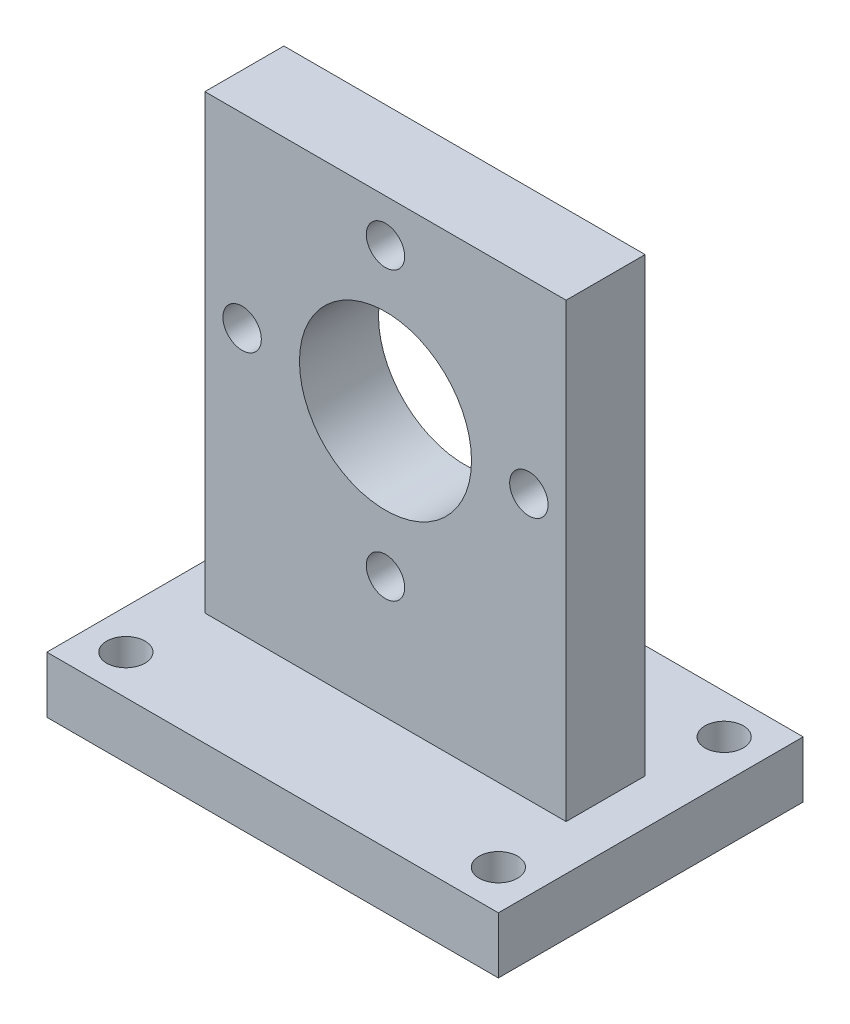
from build123d import *

# Parameters (mm, degrees)
SKETCH1_W           = 40
SKETCH1_H           = 27
SKETCH1_W_2         = 32
SKETCH1_H_2         = 7
BOSS_EXTRUDE1_DEPTH = 5
SKETCH1_3_W         = 32
SKETCH1_3_H         = 7
BOSS_EXTRUDE2_DEPTH = 45
CUT_EXTRUDE1_REACH  = 54.096
SKETCH2_R           = 7.62
CUT_EXTRUDE2_REACH  = 54.096
SKETCH4_R           = 1.7
CUT_EXTRUDE3_REACH  = 48.715
SKETCH5_R           = 1.7


with BuildPart() as part:
    # Sketch1 → Boss-Extrude1 (new body)
    with BuildSketch(Plane(origin=(0, 0, 0), x_dir=(1, 0, 0), z_dir=(0, 1, 0))):
        Rectangle(SKETCH1_W, SKETCH1_H)
        Rectangle(SKETCH1_W_2, SKETCH1_H_2, mode=Mode.SUBTRACT)
    extrude(amount=BOSS_EXTRUDE1_DEPTH)

    # Sketch1<3> → Boss-Extrude2 (add)
    with BuildSketch(Plane(origin=(0, 0, 0), x_dir=(1, 0, 0), z_dir=(0, 1, 0))):
        Rectangle(SKETCH1_3_W, SKETCH1_3_H)
    extrude(amount=BOSS_EXTRUDE2_DEPTH)

    # Sketch2 → Cut-Extrude1 (cut, up to next)
    with BuildSketch(Plane.XY.offset(3.5), mode=Mode.PRIVATE) as cut_extrude1_sk1:
        with Locations((0, 28.5)):
            Circle(SKETCH2_R)
    cut_extrude1_tool1 = extrude(cut_extrude1_sk1.sketch, amount=-CUT_EXTRUDE1_REACH, mode=Mode.PRIVATE) & part.part
    add(cut_extrude1_tool1.solids().sort_by_distance((0, 28.5, 3.5))[0], mode=Mode.SUBTRACT)

    # Sketch4 → Cut-Extrude2 (cut, up to next)
    with BuildSketch(Plane.XY.offset(3.5), mode=Mode.PRIVATE) as cut_extrude2_sk1:
        with Locations((0, 41.2)):
            Circle(SKETCH4_R)
    cut_extrude2_tool1 = extrude(cut_extrude2_sk1.sketch, amount=-CUT_EXTRUDE2_REACH, mode=Mode.PRIVATE) & part.part
    # Sketch4 → Cut-Extrude2 (cut, up to next)
    with BuildSketch(Plane.XY.offset(3.5), mode=Mode.PRIVATE) as cut_extrude2_sk2:
        with Locations((12.7, 28.5)):
            Circle(SKETCH4_R)
    cut_extrude2_tool2 = extrude(cut_extrude2_sk2.sketch, amount=-CUT_EXTRUDE2_REACH, mode=Mode.PRIVATE) & part.part
    # Sketch4 → Cut-Extrude2 (cut, up to next)
    with BuildSketch(Plane.XY.offset(3.5), mode=Mode.PRIVATE) as cut_extrude2_sk3:
        with Locations((0, 15.8)):
            Circle(SKETCH4_R)
    cut_extrude2_tool3 = extrude(cut_extrude2_sk3.sketch, amount=-CUT_EXTRUDE2_REACH, mode=Mode.PRIVATE) & part.part
    # Sketch4 → Cut-Extrude2 (cut, up to next)
    with BuildSketch(Plane.XY.offset(3.5), mode=Mode.PRIVATE) as cut_extrude2_sk4:
        with Locations((-12.7, 28.5)):
            Circle(SKETCH4_R)
    cut_extrude2_tool4 = extrude(cut_extrude2_sk4.sketch, amount=-CUT_EXTRUDE2_REACH, mode=Mode.PRIVATE) & part.part
    add(cut_extrude2_tool1.solids().sort_by_distance((0, 41.2, 3.5))[0], mode=Mode.SUBTRACT)
    add(cut_extrude2_tool2.solids().sort_by_distance((12.7, 28.5, 3.5))[0], mode=Mode.SUBTRACT)
    add(cut_extrude2_tool3.solids().sort_by_distance((0, 15.8, 3.5))[0], mode=Mode.SUBTRACT)
    add(cut_extrude2_tool4.solids().sort_by_distance((-12.7, 28.5, 3.5))[0], mode=Mode.SUBTRACT)

    # Sketch5 → Cut-Extrude3 (cut, up to next)
    with BuildSketch(Plane(origin=(0, 5, 0), x_dir=(1, 0, 0), z_dir=(0, 1, 0)), mode=Mode.PRIVATE) as cut_extrude3_sk1:
        with Locations((-16.5, 10)):
            Circle(SKETCH5_R)
    cut_extrude3_tool1 = extrude(cut_extrude3_sk1.sketch, amount=-CUT_EXTRUDE3_REACH, mode=Mode.PRIVATE) & part.part
    # Sketch5 → Cut-Extrude3 (cut, up to next)
    with BuildSketch(Plane(origin=(0, 5, 0), x_dir=(1, 0, 0), z_dir=(0, 1, 0)), mode=Mode.PRIVATE) as cut_extrude3_sk2:
        with Locations((-16.5, -10)):
            Circle(SKETCH5_R)
    cut_extrude3_tool2 = extrude(cut_extrude3_sk2.sketch, amount=-CUT_EXTRUDE3_REACH, mode=Mode.PRIVATE) & part.part
    # Sketch5 → Cut-Extrude3 (cut, up to next)
    with BuildSketch(Plane(origin=(0, 5, 0), x_dir=(1, 0, 0), z_dir=(0, 1, 0)), mode=Mode.PRIVATE) as cut_extrude3_sk3:
        with Locations((16.5, -10)):
            Circle(SKETCH5_R)
    cut_extrude3_tool3 = extrude(cut_extrude3_sk3.sketch, amount=-CUT_EXTRUDE3_REACH, mode=Mode.PRIVATE) & part.part
    # Sketch5 → Cut-Extrude3 (cut, up to next)
    with BuildSketch(Plane(origin=(0, 5, 0), x_dir=(1, 0, 0), z_dir=(0, 1, 0)), mode=Mode.PRIVATE) as cut_extrude3_sk4:
        with Locations((16.5, 10)):
            Circle(SKETCH5_R)
    cut_extrude3_tool4 = extrude(cut_extrude3_sk4.sketch, amount=-CUT_EXTRUDE3_REACH, mode=Mode.PRIVATE) & part.part
    add(cut_extrude3_tool1.solids().sort_by_distance((-16.5, 5, -10))[0], mode=Mode.SUBTRACT)
    add(cut_extrude3_tool2.solids().sort_by_distance((-16.5, 5, 10))[0], mode=Mode.SUBTRACT)
    add(cut_extrude3_tool3.solids().sort_by_distance((16.5, 5, 10))[0], mode=Mode.SUBTRACT)
    add(cut_extrude3_tool4.solids().sort_by_distance((16.5, 5, -10))[0], mode=Mode.SUBTRACT)


solid = part.part
